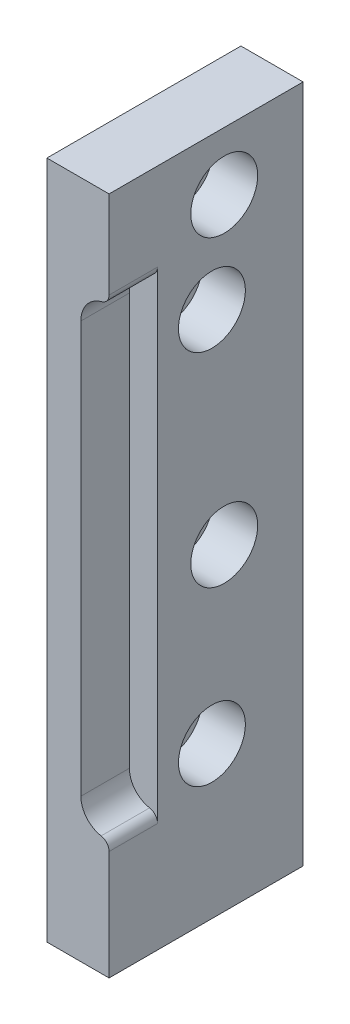
from build123d import *

# Parameters (mm, degrees)
SKETCH1_W           = 16.2814
SKETCH1_H           = 177.8
BOSS_EXTRUDE1_DEPTH = 25.4
SKETCH2_R           = 6.75767
CUT_EXTRUDE1_DEPTH  = 94.879997795
SKETCH3_R           = 8.7641176
CUT_EXTRUDE2_DEPTH  = 11.3284
CUT_EXTRUDE3_DEPTH  = 12.7
SKETCH5_R           = 5.715
CUT_EXTRUDE4_DEPTH  = 94.879997795
SKETCH6_R           = 8.763
CUT_EXTRUDE5_DEPTH  = 11.684
FILLET1_R           = 2.54


with BuildPart() as part:
    # Sketch1 → Boss-Extrude1 (new, symmetric)
    with BuildSketch(Plane.XY):
        Rectangle(SKETCH1_W, SKETCH1_H)
    extrude(amount=BOSS_EXTRUDE1_DEPTH, both=True)

    # Sketch2 → Cut-Extrude1 (cut, through all)
    with BuildSketch(Plane(origin=(8.1407, 0, 0), x_dir=(0, 0, -1), z_dir=(1, 0, 0))):
        with Locations((1.524, 49.211738)):
            Circle(SKETCH2_R)
        with Locations((1.524, -49.211738)):
            Circle(SKETCH2_R)
    extrude(amount=-CUT_EXTRUDE1_DEPTH, mode=Mode.SUBTRACT)

    # Sketch3 → Cut-Extrude2 (cut)
    with BuildSketch(Plane(origin=(8.1407, 0, 0), x_dir=(0, 0, -1), z_dir=(1, 0, 0))):
        with Locations((1.524, 49.211738)):
            Circle(SKETCH3_R)
        with Locations((1.524, -49.211738)):
            Circle(SKETCH3_R)
    extrude(amount=-CUT_EXTRUDE2_DEPTH, mode=Mode.SUBTRACT)

    # Sketch4 → Cut-Extrude3 (cut)
    with BuildSketch(Plane.XY.offset(25.4)):
        with BuildLine():
            Line((0.7493, -51.381727108), (0.7493, 56.38057714))
            ThreePointArc((0.7493, 56.38057714), (2.915188991, 61.601284707), (8.1407, 63.755558905))
            Line((8.1407, 63.755558905), (8.1407, -57.749786229))
            ThreePointArc((8.1407, -57.749786229), (2.985440135, -56.259866378), (0.7493, -51.381727108))
        make_face()
    extrude(amount=-CUT_EXTRUDE3_DEPTH, mode=Mode.SUBTRACT)

    # Sketch5 → Cut-Extrude4 (cut, through all)
    with BuildSketch(Plane(origin=(8.1407, 0, 0), x_dir=(0, 0, -1), z_dir=(1, 0, 0))):
        with Locations((4.7498, -5.715)):
            Circle(SKETCH5_R)
        with Locations((4.7498, 73.66)):
            Circle(SKETCH5_R)
    extrude(amount=-CUT_EXTRUDE4_DEPTH, mode=Mode.SUBTRACT)

    # Sketch6 → Cut-Extrude5 (cut)
    with BuildSketch(Plane(origin=(8.1407, 0, 0), x_dir=(0, 0, -1), z_dir=(1, 0, 0))):
        with Locations((4.7498, -5.715)):
            Circle(SKETCH6_R)
        with Locations((4.7498, 73.66)):
            Circle(SKETCH6_R)
    extrude(amount=-CUT_EXTRUDE5_DEPTH, mode=Mode.SUBTRACT)

    # Fillet1
    fillet1_edges = [part.edges().sort_by_distance(p)[0] for p in [
        (8.1407, -57.749786229, 19.05),
        (8.1407, 63.755558905, 19.05),
    ]]
    fillet(fillet1_edges, radius=FILLET1_R)


solid = part.part
